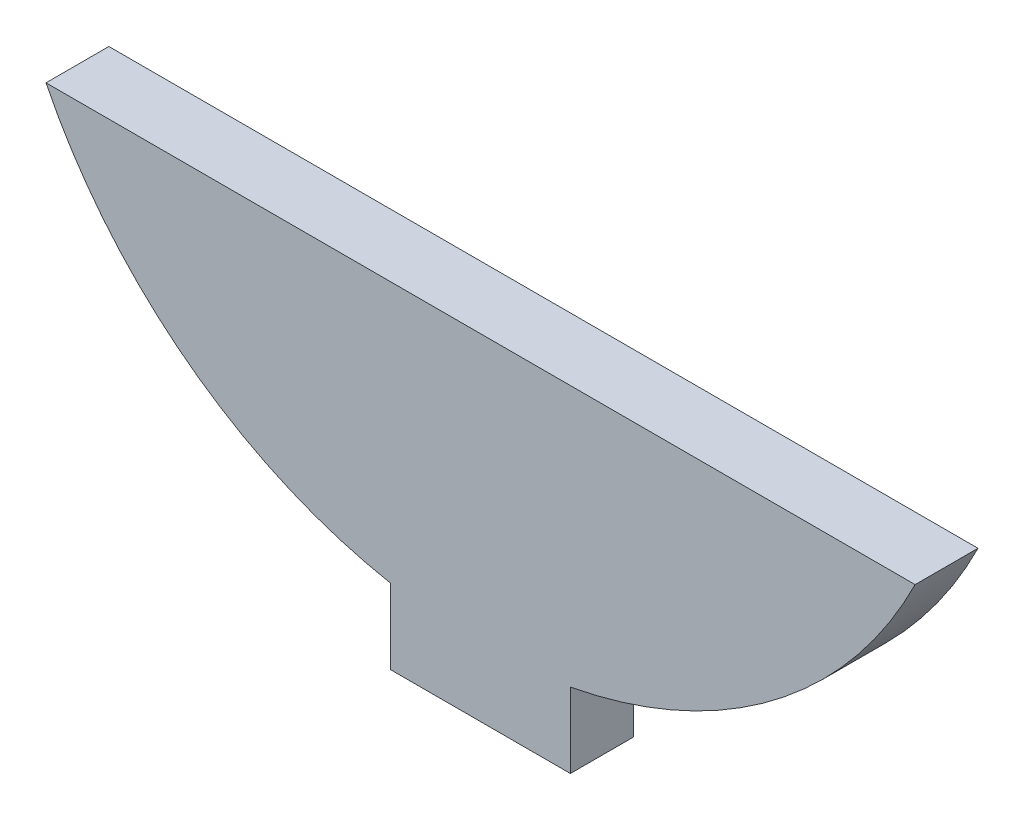
from build123d import *

# Parameters (mm, degrees)
EXTRUDE_1_DEPTH = 3.5


with BuildPart() as part:
    # 草图1 → 凸台-拉伸1 (new body)
    with BuildSketch(Plane.XY):
        with BuildLine():
            Line((24.186773245, 16.616499161), (-24.186773245, 16.616499161))
            ThreePointArc((-24.186773245, 16.616499161), (-16.30242139, 7.093695979), (-5, 2.083500839))
            Line((-5, 2.083500839), (-5, -2.083500839))
            Line((-5, -2.083500839), (5, -2.083500839))
            Line((5, -2.083500839), (5, 2.083500839))
            ThreePointArc((5, 2.083500839), (16.30242139, 7.093695979), (24.186773245, 16.616499161))
        make_face()
    extrude(amount=EXTRUDE_1_DEPTH)


solid = part.part
